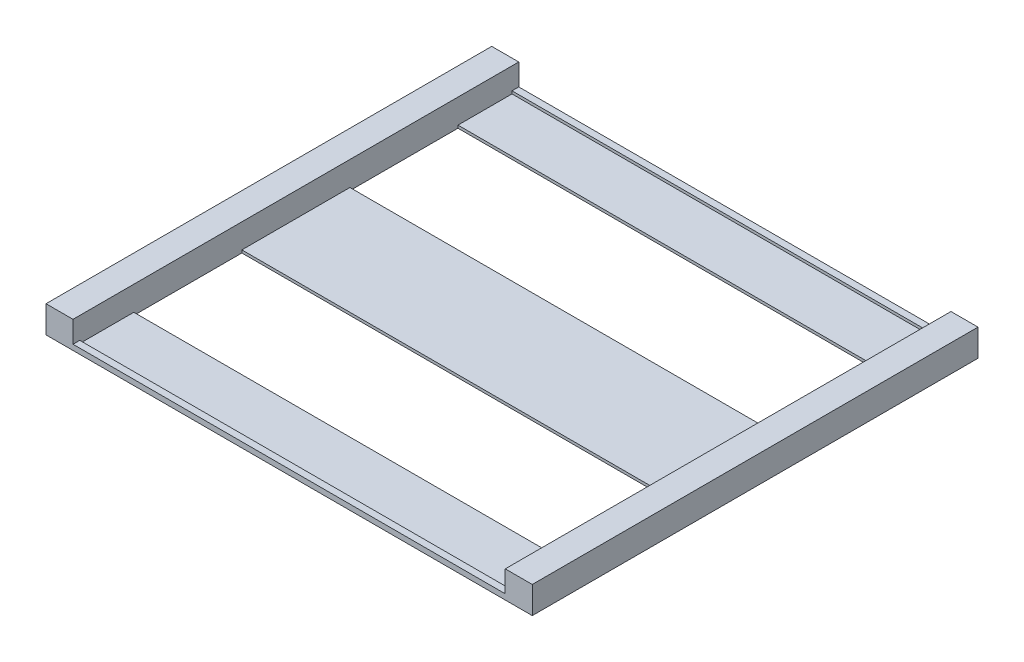
from build123d import *

# Parameters (mm, degrees)
SKETCH5_W           = 180
SKETCH5_H           = 165
SKETCH5_W_2         = 160
SKETCH5_H_2         = 40
BOSS_EXTRUDE3_DEPTH = 1
SKETCH6_W           = 10
SKETCH6_H           = 165
BOSS_EXTRUDE4_DEPTH = 9
SKETCH7_W           = 160
SKETCH7_H           = 2.5
BOSS_EXTRUDE5_DEPTH = 1
SKETCH10_W          = 160
SKETCH10_H          = 2.5
BOSS_EXTRUDE6_DEPTH = 1


with BuildPart() as part:
    # Sketch5 → Boss-Extrude3 (new body)
    with BuildSketch(Plane(origin=(0, 0, 0), x_dir=(1, 0, 0), z_dir=(0, 1, 0))):
        Rectangle(SKETCH5_W, SKETCH5_H)
        with Locations((0, -40)):
            Rectangle(SKETCH5_W_2, SKETCH5_H_2, mode=Mode.SUBTRACT)
        with Locations((0, 40)):
            Rectangle(SKETCH5_W_2, SKETCH5_H_2, mode=Mode.SUBTRACT)
    extrude(amount=BOSS_EXTRUDE3_DEPTH)

    # Sketch6 → Boss-Extrude4 (add)
    with BuildSketch(Plane(origin=(0, 1, 0), x_dir=(1, 0, 0), z_dir=(0, 1, 0))):
        with Locations((-85, 0)):
            Rectangle(SKETCH6_W, SKETCH6_H)
        with Locations((85, 0)):
            Rectangle(SKETCH6_W, SKETCH6_H)
    extrude(amount=BOSS_EXTRUDE4_DEPTH)

    # Sketch7 → Boss-Extrude5 (add)
    with BuildSketch(Plane(origin=(0, 1, 0), x_dir=(1, 0, 0), z_dir=(0, 1, 0))):
        with Locations((0, -81.25)):
            Rectangle(SKETCH7_W, SKETCH7_H)
    extrude(amount=BOSS_EXTRUDE5_DEPTH)

    # Sketch10 → Boss-Extrude6 (add)
    with BuildSketch(Plane(origin=(0, 1, 0), x_dir=(1, 0, 0), z_dir=(0, 1, 0))):
        with Locations((0, 81.25)):
            Rectangle(SKETCH10_W, SKETCH10_H)
    extrude(amount=BOSS_EXTRUDE6_DEPTH)


solid = part.part
